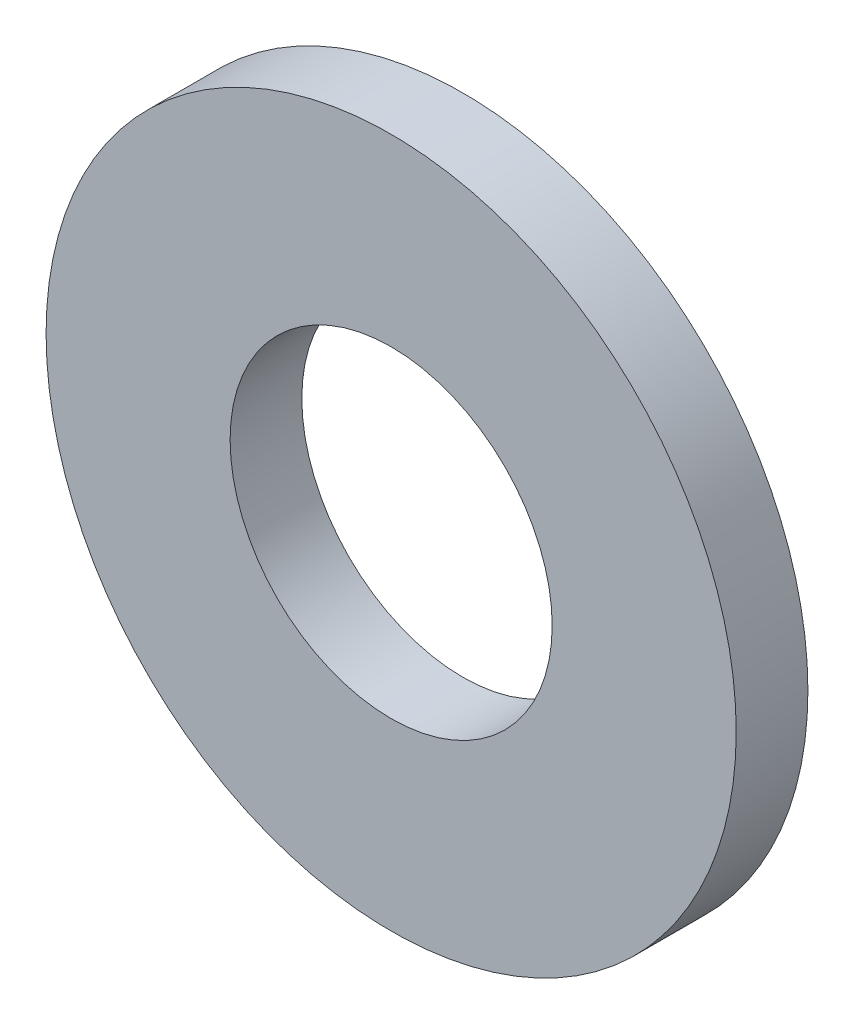
from build123d import *

# Parameters (mm, degrees)
SKETCH1_R      = 9
SKETCH1_R_2    = 4.2
EXTRUDE1_DEPTH = 1.87


with BuildPart() as part:
    # Sketch1 → Extrude1 (new body)
    with BuildSketch(Plane.XY):
        Circle(SKETCH1_R)
        Circle(SKETCH1_R_2, mode=Mode.SUBTRACT)
    extrude(amount=-EXTRUDE1_DEPTH)


solid = part.part
